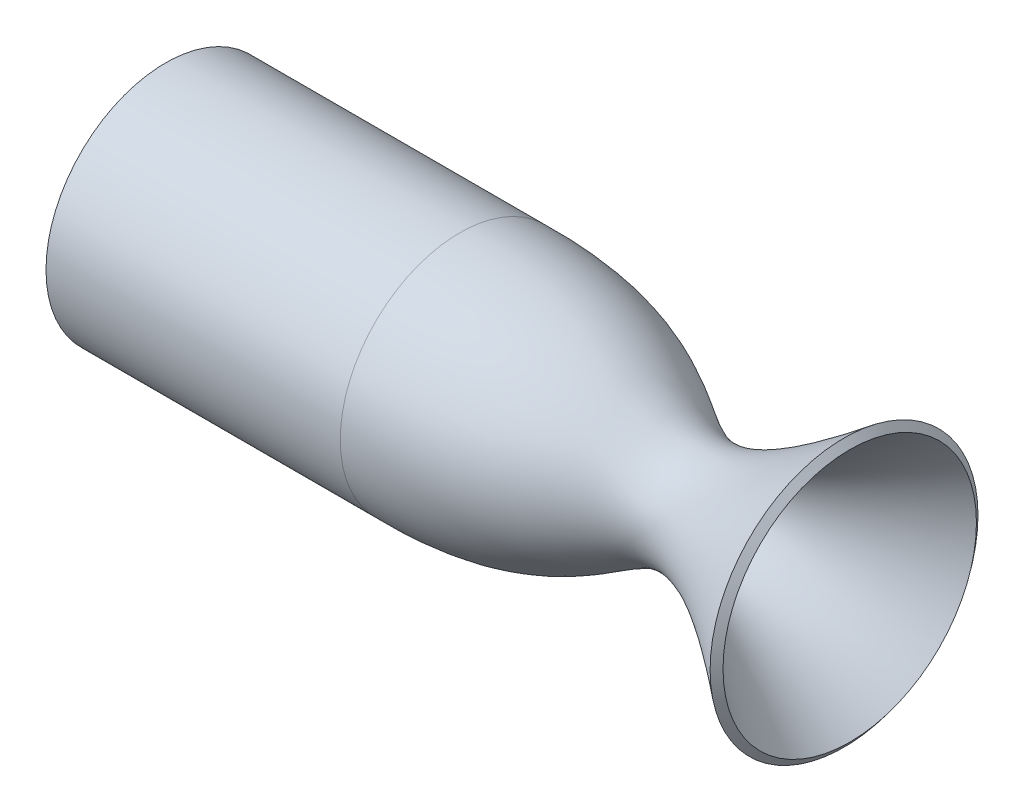
from build123d import *


with BuildPart() as part:
    # Sketch2 → Revolve1 (revolve)
    with BuildSketch(Plane.XY, mode=Mode.PRIVATE) as revolve1_sk:
        with BuildLine():
            Line((-140, 65), (19.954223861, 65))
            add(Edge.make_bspline(
                [(19.954223861, 65), (21.016036949, 65.019364415), (23.155754142, 65.047133931), (27.308551501, 65.056367434), (32.353198871, 64.984650174), (38.152864496, 64.771098732), (45.567688357, 64.32486699), (54.255095035, 63.479775498), (63.813883484, 62.056181028), (72.567017756, 60.273903927), (83.242872896, 57.488773814), (94.867435167, 53.373767517), (106.518267243, 47.87450931), (116.322752818, 42.298539812), (124.736044428, 37.141710874), (132.197152427, 32.876448525), (139.118198638, 29.887038599), (146.009326462, 28.369530473), (153.724403185, 28.498164942), (163.163761497, 30.774524673), (172.93972339, 34.968320575), (182.118464779, 39.947020221), (189.735067248, 44.546297097), (198.139536323, 50.063346613), (205.847141634, 55.467762959), (212.465840749, 60.301248812), (217.661687494, 64.186041861), (222.197887983, 67.650369213), (225.939095655, 70.549100478), (227.873902956, 72.061946017), (228.830902799, 72.813469047)],
                knots=[0.000111982, 0.000111982, 0.000111982, 0.000111982, 0.007923607, 0.015735232, 0.031358482, 0.046981733, 0.062604983, 0.093851484, 0.125097984, 0.156344485, 0.187590985, 0.250083986, 0.312576987, 0.375069989, 0.43756299, 0.500055991, 0.562548992, 0.625041993, 0.687534994, 0.750027995, 0.812520997, 0.843767497, 0.875013998, 0.906260498, 0.937506999, 0.953130249, 0.968753499, 0.98437675, 0.992188375, 1, 1, 1, 1], degree=3))
            Line((228.830902799, 72.813469047), (231.918980433, 68.881068187))
            add(Edge.make_bspline(
                [(20.045394315, 60.000831274), (155.133832213, 62.464455683), (107.158700851, -29.09201306), (231.918980433, 68.881068187)],
                knots=[0.000111982, 0.000111982, 0.000111982, 0.000111982, 1, 1, 1, 1], degree=3))
            ThreePointArc((20.045394315, 60.000831274), (19.999810983, 60.000207823), (19.954223861, 60))
            Line((19.954223861, 60), (-140, 60))
            Line((-140, 60), (-140, 65))
        make_face()
    revolve(revolve1_sk.sketch.rotate(Axis((-140, 0, 0), (1, 0, 0)), 90), axis=Axis((-140, 0, 0), (1, 0, 0)))


solid = part.part
